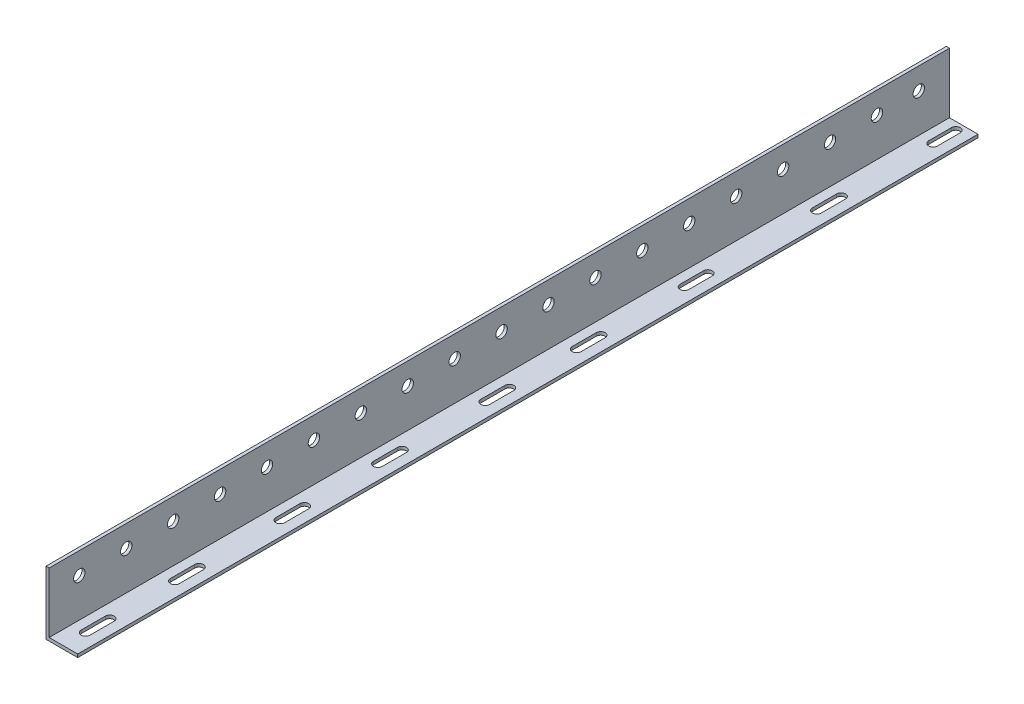
from build123d import *

# Parameters (mm, degrees)
BOSS_EXTRUDE1_DEPTH = 710
CUT_EXTRUDE2_DEPTH  = 10
SKETCH2_R           = 4.5
CUT_EXTRUDE3_DEPTH  = 10


with BuildPart() as part:
    # Sketch1 → Boss-Extrude1 (new body)
    with BuildSketch(Plane.XY):
        Polygon((-9.451520251, 23.80952381), (-9.451520251, -26.19047619), (15.548479749, -26.19047619), (15.548479749, -23.69047619), (-6.951520251, -23.69047619), (-6.951520251, 23.80952381), align=None)
    extrude(amount=BOSS_EXTRUDE1_DEPTH)

    # Sketch3 → Cut-Extrude2 (cut)
    with BuildSketch(Plane(origin=(0, -23.69047619, 0), x_dir=(1, 0, 0), z_dir=(0, 1, 0))):
        with BuildLine():
            Line((0.571135038, -219.92842441), (0.571135038, -200.92842441))
            ThreePointArc((0.571135038, -200.92842441), (4.071135038, -198.06459908), (7.571135038, -200.92842441))
            Line((7.571135038, -200.92842441), (7.571135038, -219.92842441))
            ThreePointArc((7.571135038, -219.92842441), (4.071135038, -223.510363015), (0.571135038, -219.92842441))
        make_face()
        with BuildLine():
            Line((0.569964611, -115.462655238), (0.570877182, -96.46265526))
            ThreePointArc((0.570877182, -96.46265526), (4.072165698, -92.963944251), (7.570876708, -96.465232767))
            Line((7.570876708, -96.465232767), (7.571895363, -115.465232739))
            ThreePointArc((7.571895363, -115.465232739), (4.069587599, -119.110618262), (0.569964611, -115.462655238))
        make_face()
        with BuildLine():
            Line((0.583868221, -24.003598612), (0.583868221, -6.003598612))
            ThreePointArc((0.583868221, -6.003598612), (4.083868221, -2.503598612), (7.583868221, -6.003598612))
            Line((7.583868221, -6.003598612), (7.583868221, -24.003598612))
            ThreePointArc((7.583868221, -24.003598612), (4.083868221, -27.503598612), (0.583868221, -24.003598612))
        make_face()
        with BuildLine():
            Line((0.551168836, -304.990076897), (0.551168836, -285.990076897))
            ThreePointArc((0.551168836, -285.990076897), (4.051168836, -282.538492606), (7.551168836, -285.990076897))
            Line((7.551168836, -285.990076897), (7.551168836, -304.990076897))
            ThreePointArc((7.551168836, -304.990076897), (4.051168836, -308.572015501), (0.551168836, -304.990076897))
        make_face()
        with BuildLine():
            Line((0.549325866, -377.049780646), (0.549325866, -358.049780646))
            ThreePointArc((0.549325866, -358.049780646), (4.049325866, -354.598196355), (7.549325866, -358.049780646))
            Line((7.549325866, -358.049780646), (7.549325866, -377.049780646))
            ThreePointArc((7.549325866, -377.049780646), (4.049325866, -380.63171925), (0.549325866, -377.049780646))
        make_face()
        with BuildLine():
            Line((0.543910271, -461.67525715), (0.543910271, -442.67525715))
            ThreePointArc((0.543910271, -442.67525715), (4.043910271, -439.223672859), (7.543910271, -442.67525715))
            Line((7.543910271, -442.67525715), (7.543910271, -461.67525715))
            ThreePointArc((7.543910271, -461.67525715), (4.043910271, -465.257195754), (0.543910271, -461.67525715))
        make_face()
        with BuildLine():
            Line((0.482021973, -538.640227915), (0.482021973, -519.640227915))
            ThreePointArc((0.482021973, -519.640227915), (3.982021973, -516.188643625), (7.482021973, -519.640227915))
            Line((7.482021973, -519.640227915), (7.482021973, -538.640227915))
            ThreePointArc((7.482021973, -538.640227915), (3.982021973, -542.22216652), (0.482021973, -538.640227915))
        make_face()
        with BuildLine():
            Line((0.537615818, -621.781220279), (0.537615818, -602.781220279))
            ThreePointArc((0.537615818, -602.781220279), (4.037615818, -599.329635989), (7.537615818, -602.781220279))
            Line((7.537615818, -602.781220279), (7.537615818, -621.781220279))
            ThreePointArc((7.537615818, -621.781220279), (4.037615818, -625.363158884), (0.537615818, -621.781220279))
        make_face()
        with BuildLine():
            Line((0.532196004, -692.166466569), (0.532196004, -673.166466569))
            ThreePointArc((0.532196004, -673.166466569), (4.032196004, -669.714882279), (7.532196004, -673.166466569))
            Line((7.532196004, -673.166466569), (7.532196004, -692.166466569))
            ThreePointArc((7.532196004, -692.166466569), (4.032196004, -695.748405174), (0.532196004, -692.166466569))
        make_face()
    extrude(amount=-CUT_EXTRUDE2_DEPTH, mode=Mode.SUBTRACT)

    # Sketch2 → Cut-Extrude3 (cut)
    with BuildSketch(Plane(origin=(-6.951520251, 0, 0), x_dir=(0, 0, -1), z_dir=(1, 0, 0))):
        with Locations(Location((-649.198051525, 6.719410966, 0), (0, 0, 90))):
            Circle(SKETCH2_R)
        with Locations(Location((-612.198051525, 6.716309021, 0), (0, 0, 90))):
            Circle(SKETCH2_R)
        with Locations(Location((-575.198051525, 6.713207076, 0), (0, 0, 90))):
            Circle(SKETCH2_R)
        with Locations(Location((-242.198051785, 6.685289571, 0), (0, 0, 90))):
            Circle(SKETCH2_R)
        with Locations(Location((-279.198051785, 6.688391516, 0), (0, 0, 90))):
            Circle(SKETCH2_R)
        with Locations(Location((-538.198051525, 6.710105131, 0), (0, 0, 90))):
            Circle(SKETCH2_R)
        with Locations(Location((-501.198051525, 6.707003186, 0), (0, 0, 90))):
            Circle(SKETCH2_R)
        with Locations(Location((-464.198051525, 6.703901241, 0), (0, 0, 90))):
            Circle(SKETCH2_R)
        with Locations(Location((-427.198051525, 6.700799296, 0), (0, 0, 90))):
            Circle(SKETCH2_R)
        with Locations(Location((-390.198051525, 6.697697351, 0), (0, 0, 90))):
            Circle(SKETCH2_R)
        with Locations(Location((-353.198051655, 6.694595406, 0), (0, 0, 90))):
            Circle(SKETCH2_R)
        with Locations(Location((-316.198051785, 6.691493461, 0), (0, 0, 90))):
            Circle(SKETCH2_R)
        with Locations(Location((-686.198051395, 6.722512911, 0), (0, 0, 90))):
            Circle(SKETCH2_R)
        with Locations(Location((-24.198051395, 6.667013246, 0), (0, 0, 90))):
            Circle(SKETCH2_R)
        with Locations(Location((-57.198052435, 6.669779846, 0), (0, 0, 90))):
            Circle(SKETCH2_R)
        with Locations(Location((-205.198051915, 6.682187626, 0), (0, 0, 90))):
            Circle(SKETCH2_R)
        with Locations(Location((-168.198052045, 6.679085681, 0), (0, 0, 90))):
            Circle(SKETCH2_R)
        with Locations(Location((-131.198052175, 6.675983736, 0), (0, 0, 90))):
            Circle(SKETCH2_R)
        with Locations(Location((-94.198052305, 6.672881791, 0), (0, 0, 90))):
            Circle(SKETCH2_R)
    extrude(amount=-CUT_EXTRUDE3_DEPTH, mode=Mode.SUBTRACT)


solid = part.part
